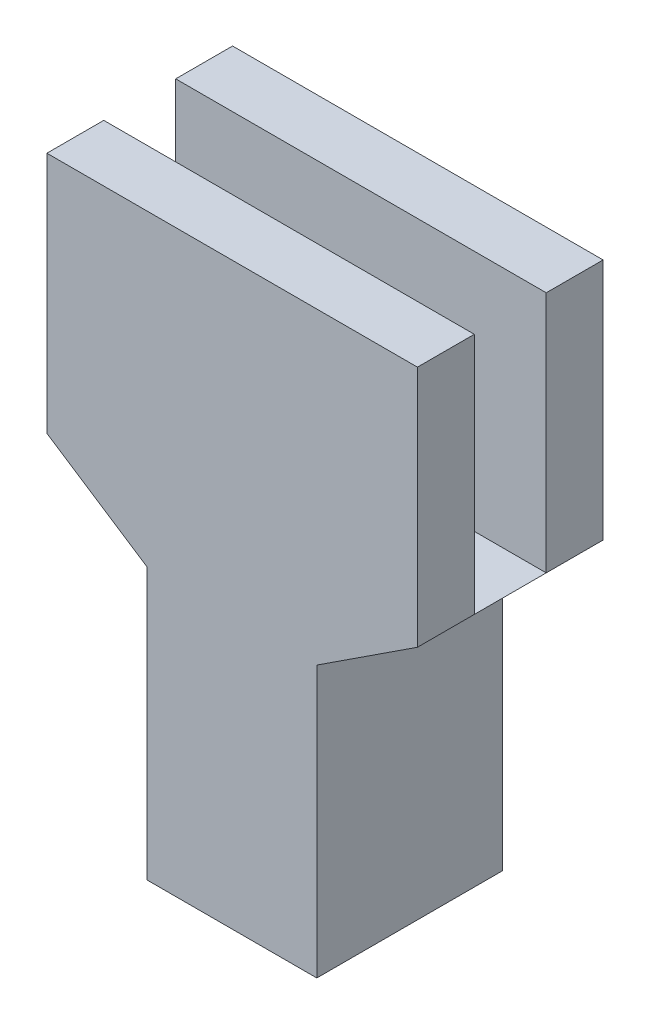
from build123d import *

# Parameters (mm, degrees)
EXTRUDE_1_DEPTH    = 50
SKETCH1_R          = 5
CUT_EXTRUDE1_DEPTH = 20
SKETCH2_W          = 19.36508075
SKETCH2_H          = 147.157362998
CUT_EXTRUDE2_DEPTH = 155.236083451


with BuildPart() as part:
    # Эскиз1 → Вытянуть1 (new body)
    with BuildSketch(Plane.XY):
        Polygon((49.89246994, 41.122656045), (22.824133965, 23.436424123), (22.792974544, -49.563569227), (-22.910878505, -49.563569227), (-22.910878505, 23.436424124), (-49.89246994, 41.122656045), (-49.89246994, 106.450623349), (49.89246994, 106.450623349), align=None)
    extrude(amount=EXTRUDE_1_DEPTH)

    # Sketch1 → Cut-Extrude1 (cut)
    with BuildSketch(Plane.XZ.offset(49.563569227)):
        with Locations(Location((0, 25, 0), (0, 0, 270))):
            Circle(SKETCH1_R)
    extrude(amount=-CUT_EXTRUDE1_DEPTH, mode=Mode.SUBTRACT)

    # Sketch2 → Cut-Extrude2 (cut, through all)
    with BuildSketch(Plane.ZY.offset(49.89246994)):
        with Locations((25, 114.701337544)):
            Rectangle(SKETCH2_W, SKETCH2_H)
    extrude(amount=-CUT_EXTRUDE2_DEPTH, mode=Mode.SUBTRACT)


solid = part.part
